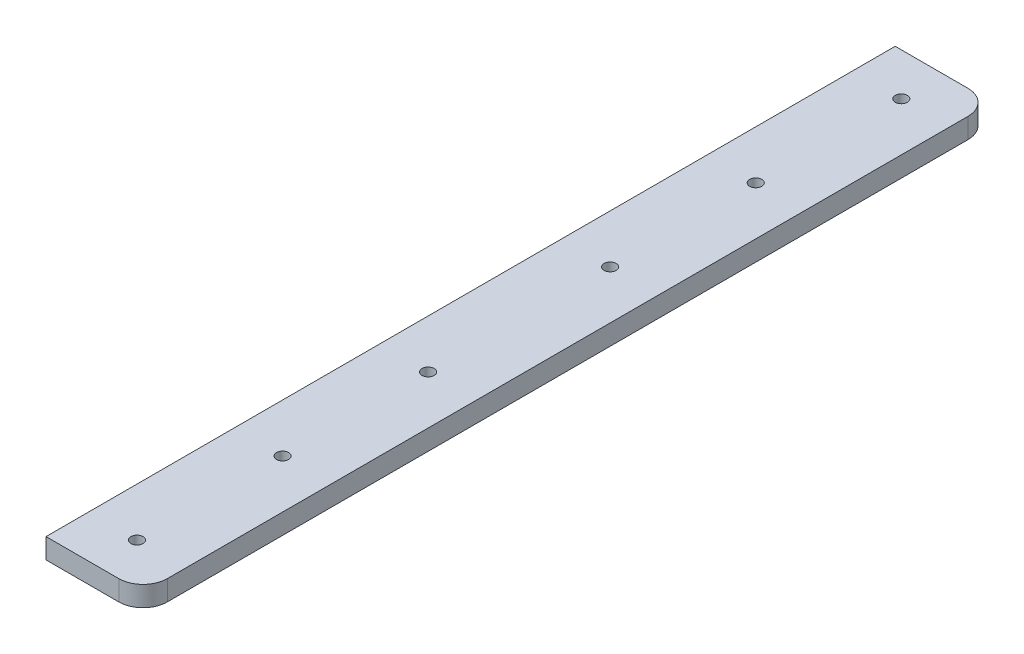
from build123d import *

# Parameters (mm, degrees)
SKETCH1_R           = 1.5
BOSS_EXTRUDE1_DEPTH = 5


with BuildPart() as part:
    # Sketch1 → Boss-Extrude1 (new body)
    with BuildSketch(Plane(origin=(0, 0, 0), x_dir=(1, 0, 0), z_dir=(0, 1, 0))):
        with BuildLine():
            Line((-12, -105), (-12, 105))
            Line((-12, 105), (6, 105))
            ThreePointArc((6, 105), (10.242640687, 103.242640687), (12, 99))
            Line((12, 99), (12, -99))
            ThreePointArc((12, -99), (10.242640687, -103.242640687), (6, -105))
            Line((6, -105), (-12, -105))
        make_face()
        with Locations(Location((0, -94.5, 0), (0, 0, 270))):
            Circle(SKETCH1_R, mode=Mode.SUBTRACT)
        with Locations(Location((0, -58.5, 0), (0, 0, 270))):
            Circle(SKETCH1_R, mode=Mode.SUBTRACT)
        with Locations(Location((0, -22.5, 0), (0, 0, 270))):
            Circle(SKETCH1_R, mode=Mode.SUBTRACT)
        with Locations(Location((0, 94.5, 0), (0, 0, 90))):
            Circle(SKETCH1_R, mode=Mode.SUBTRACT)
        with Locations(Location((0, 58.5, 0), (0, 0, 90))):
            Circle(SKETCH1_R, mode=Mode.SUBTRACT)
        with Locations(Location((0, 22.5, 0), (0, 0, 90))):
            Circle(SKETCH1_R, mode=Mode.SUBTRACT)
    extrude(amount=BOSS_EXTRUDE1_DEPTH)


solid = part.part
